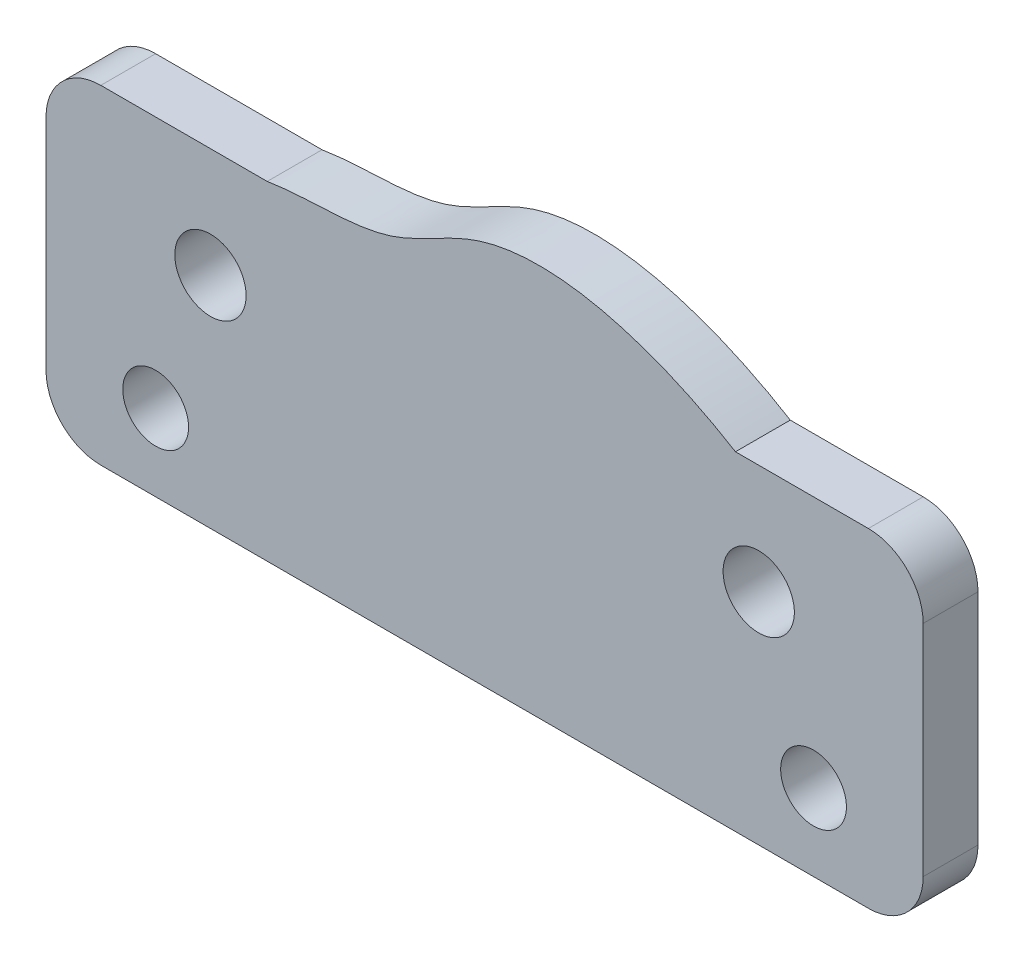
from build123d import *

# Parameters (mm, degrees)
ESQUISSE1_W                  = 80
ESQUISSE1_H                  = 30
BOSS_EXTRU_1_DEPTH           = 5
ENL_V_MAT_EXTRU_1_DEPTH      = 86.586213843
ENL_V_MAT_EXTRU_1_DEPTH_BACK = 86.586213843
ESQUISSE2_R                  = 3.25
ESQUISSE2_R_2                = 3
CONG_1_R                     = 5
BOSS_EXTRU_2_DEPTH           = 5


with BuildPart() as part:
    # Esquisse1 → Boss.-Extru.1 (new body)
    with BuildSketch(Plane.XY):
        with Locations((40, 15)):
            Rectangle(ESQUISSE1_W, ESQUISSE1_H)
    extrude(amount=BOSS_EXTRU_1_DEPTH)

    # Esquisse2 → Enlèv. mat.-Extru.1 (cut, two sides: drawn at the far end of the back side and taken through both)
    with BuildSketch(Plane.XY.offset(5).offset(-ENL_V_MAT_EXTRU_1_DEPTH_BACK)):
        with Locations((15, 20)):
            Circle(ESQUISSE2_R)
        with Locations(Location((65, 20, 0), (0, 0, 180))):
            Circle(ESQUISSE2_R)
        with Locations((10, 7)):
            Circle(ESQUISSE2_R_2)
        with Locations(Location((70, 7, 0), (0, 0, 180))):
            Circle(ESQUISSE2_R_2)
    extrude(amount=ENL_V_MAT_EXTRU_1_DEPTH + ENL_V_MAT_EXTRU_1_DEPTH_BACK, mode=Mode.SUBTRACT)

    # Congé1
    cong_1_edges = [part.edges().sort_by_distance(p)[0] for p in [
        (0, 30, 2.5),
        (80, 30, 2.5),
        (80, 0, 2.5),
        (0, 0, 2.5),
    ]]
    fillet(cong_1_edges, radius=CONG_1_R)

    # Esquisse3 → Boss.-Extru.2 (add)
    with BuildSketch(Plane.XY.offset(5)):
        with BuildLine():
            Line((20.175853906, 30), (62.880368617, 30))
            add(Edge.make_bspline(
                [(62.880368617, 30), (56.248577834, 34.044178021), (43.342547907, 38.777474561), (30.753908623, 29.855151718), (23.756853958, 30.615618698), (20.175853906, 30)],
                knots=[0, 0, 0, 0, 0.562893367, 0.745092862, 1, 1, 1, 1], degree=3))
        make_face()
    extrude(amount=-BOSS_EXTRU_2_DEPTH)


solid = part.part
